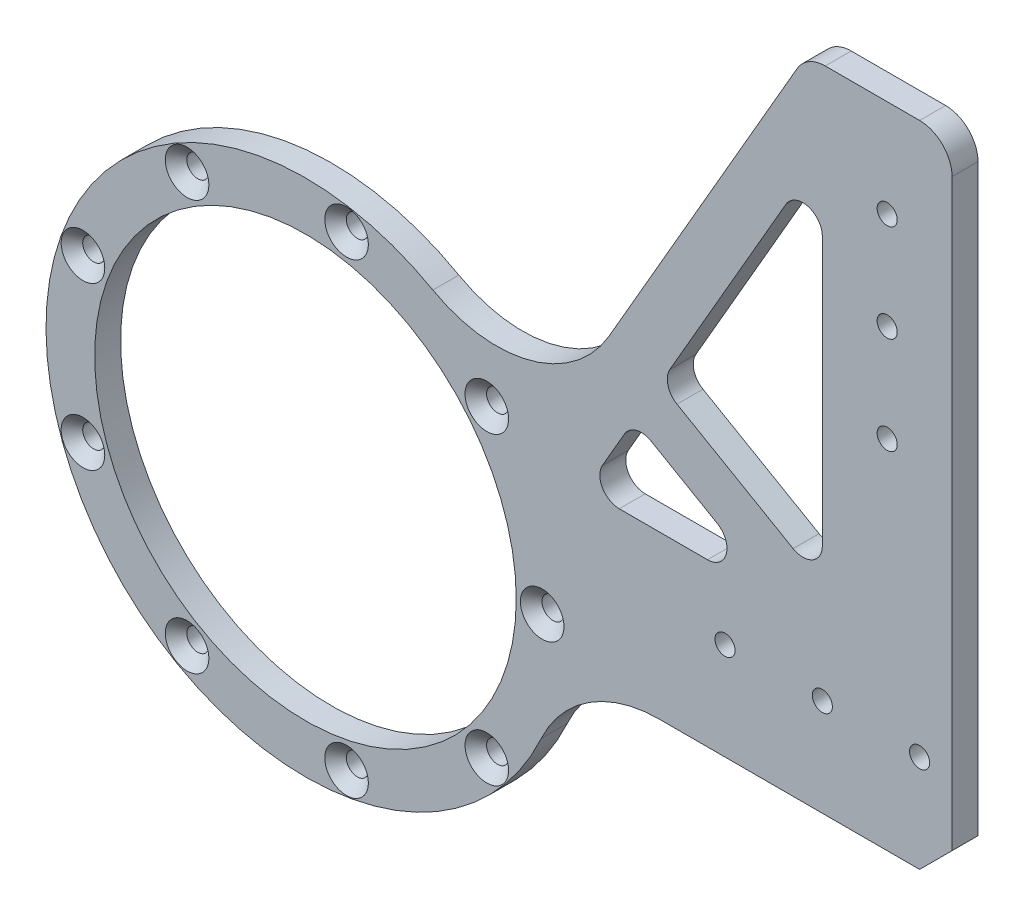
from build123d import *

# Parameters (mm, degrees)
SKETCH_1_R                   = 40
SKETCH_1_R_2                 = 32.5
EXTRUDE_1_DEPTH              = 4
HOLE_WIZARD_M3_1_D           = 3.4
HOLE_WIZARD_M3_1_CSINK_D     = 6.72
HOLE_WIZARD_M3_1_CSINK_ANGLE = 90
EXTRUDE_START                = -4
SKETCH_4_R                   = 1.55
EXTRUDE_2_DEPTH              = 4
FILLET_2_R                   = 20
CHAMFER_1_SIZE               = 5
FILLET_4_R                   = 3
FILLET_5_R                   = 5


with BuildPart() as part:
    # 草图1 → 凸台-拉伸1 (new body)
    with BuildSketch(Plane.XY):
        Circle(SKETCH_1_R)
        Circle(SKETCH_1_R_2, mode=Mode.SUBTRACT)
    extrude(amount=EXTRUDE_1_DEPTH)

    # M3 六角凹锥坑螺钉的锥形沉头孔1 (through all)
    with Locations(Plane.XY.offset(4)):
        with Locations((27.960622174, 23.461747754), (36.5, 0), (27.960622174, -23.461747754), (6.338158485, -35.945482985), (-18.25, -31.609927238), (-34.298780659, -12.483735231), (-34.298780659, 12.483735231), (-18.25, 31.609927238), (6.338158485, 35.945482985)):
            CounterSinkHole(HOLE_WIZARD_M3_1_D / 2, HOLE_WIZARD_M3_1_CSINK_D / 2, counter_sink_angle=HOLE_WIZARD_M3_1_CSINK_ANGLE)

    # 草图4 → 凸台-拉伸2 (add)
    with BuildSketch(Plane.XY.offset(4).offset(EXTRUDE_START)):
        with BuildLine():
            Line((39.686269666, -5), (99.686269666, -5))
            Line((99.686269666, -5), (99.686269666, 95))
            Line((99.686269666, 95), (77.249935548, 95))
            Line((77.249935548, 95), (34.29141524, 20.593660209))
            ThreePointArc((34.29141524, 20.593660209), (39.139919861, 8.25025292), (39.686269666, -5))
        make_face()
        with Locations((79.686269666, 10)):
            Circle(SKETCH_4_R, mode=Mode.SUBTRACT)
        with Locations((94.686269666, 10)):
            Circle(SKETCH_4_R, mode=Mode.SUBTRACT)
        with Locations((64.686269666, 10)):
            Circle(SKETCH_4_R, mode=Mode.SUBTRACT)
        with Locations((89.686269666, 80)):
            Circle(SKETCH_4_R, mode=Mode.SUBTRACT)
        with Locations((89.686269666, 65)):
            Circle(SKETCH_4_R, mode=Mode.SUBTRACT)
        with Locations((89.686269666, 50)):
            Circle(SKETCH_4_R, mode=Mode.SUBTRACT)
        Polygon((54.686269666, 39.918584287), (79.686269666, 25.484827557), (79.686269666, 83.219854476), align=None, mode=Mode.SUBTRACT)
        Polygon((50.686269666, 32.990381057), (73.186269666, 20), (43.186269666, 20), align=None, mode=Mode.SUBTRACT)
    extrude(amount=EXTRUDE_2_DEPTH)

    # 圆角2
    fillet_2_edges = [part.edges().sort_by_distance(p)[0] for p in [
        (34.29141524, 20.593660209, 2),
        (39.686269666, -5, 2),
    ]]
    fillet(fillet_2_edges, radius=FILLET_2_R)

    # 倒角1
    chamfer_1_edges = [part.edges().sort_by_distance(p)[0] for p in [
        (99.686269666, -5, 2),
    ]]
    chamfer(chamfer_1_edges, length=CHAMFER_1_SIZE)

    # 圆角4
    fillet_4_edges = [part.edges().sort_by_distance(p)[0] for p in [
        (54.686269666, 39.918584287, 2),
        (79.686269666, 25.484827557, 2),
        (79.686269666, 83.219854476, 2),
        (73.186269666, 20, 2),
        (50.686269666, 32.990381057, 2),
        (43.186269666, 20, 2),
    ]]
    fillet(fillet_4_edges, radius=FILLET_4_R)

    # 圆角5
    fillet_5_edges = [part.edges().sort_by_distance(p)[0] for p in [
        (77.249935548, 95, 2),
        (99.686269666, 95, 2),
    ]]
    fillet(fillet_5_edges, radius=FILLET_5_R)


solid = part.part
